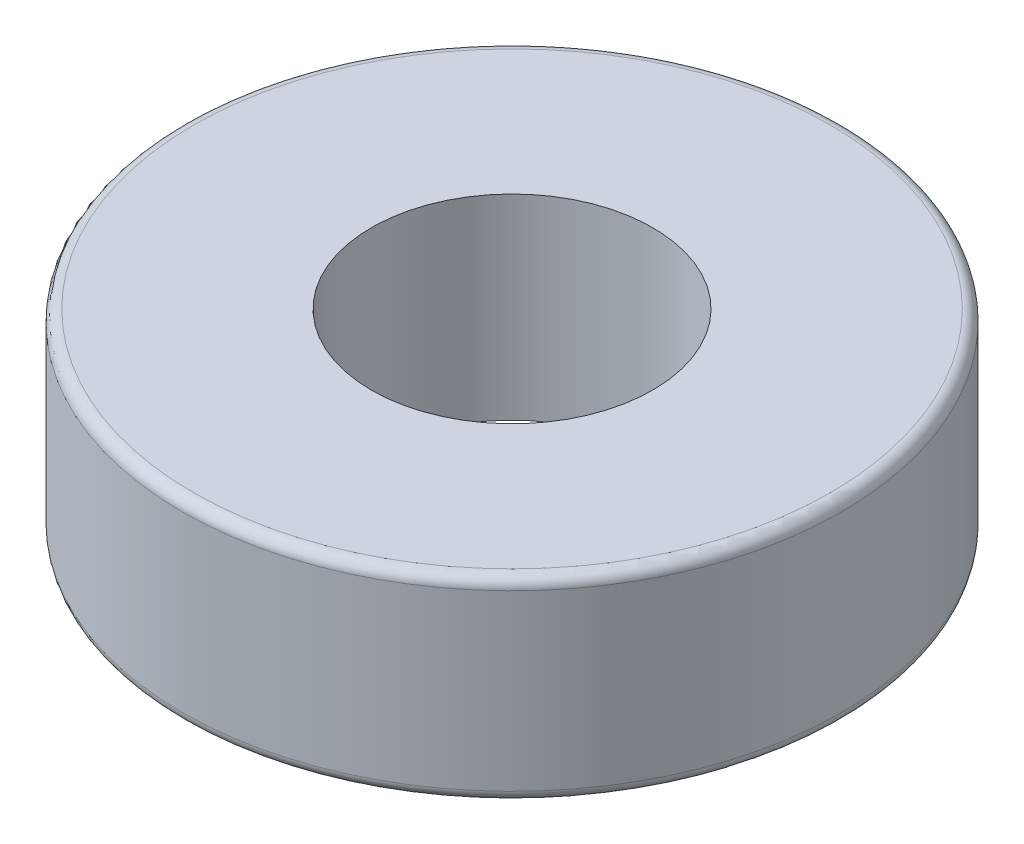
from build123d import *

# Parameters (mm, degrees)
SKETCH1_R           = 23.495
SKETCH1_R_2         = 10.033
BOSS_EXTRUDE1_DEPTH = 13.97
FILLET1_R           = 0.79375


with BuildPart() as part:
    # Sketch1 → Boss-Extrude1 (new body)
    with BuildSketch(Plane(origin=(0, 0, 0), x_dir=(1, 0, 0), z_dir=(0, 1, 0))):
        with Locations(Location((0, 0, 0), (0, 0, 270))):
            Circle(SKETCH1_R)
        with Locations(Location((0, 0, 0), (0, 0, 270))):
            Circle(SKETCH1_R_2, mode=Mode.SUBTRACT)
    extrude(amount=BOSS_EXTRUDE1_DEPTH)

    # Fillet1
    fillet1_edges = [part.edges().sort_by_distance(p)[0] for p in [
        (0, 0, -23.495),
        (0, 13.97, -23.495),
    ]]
    fillet(fillet1_edges, radius=FILLET1_R)


solid = part.part
